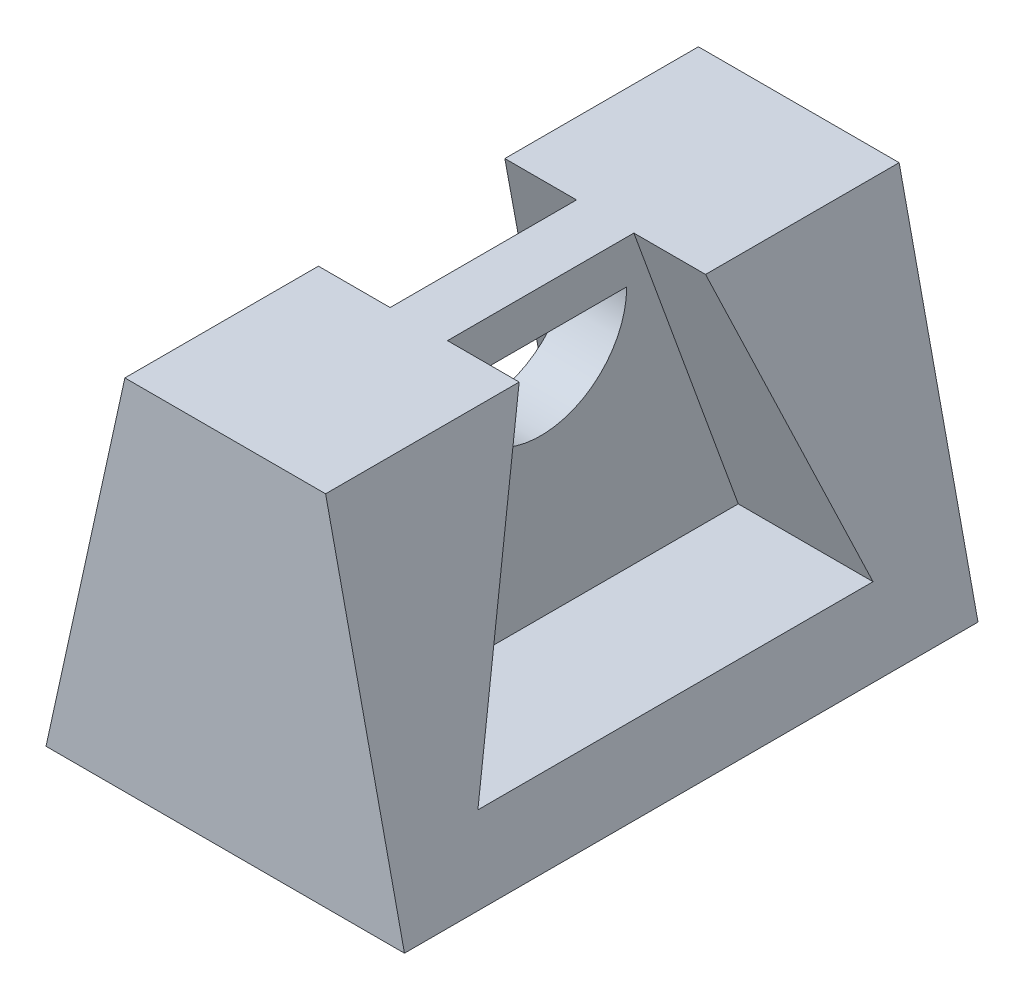
from build123d import *

# Parameters (mm, degrees)
EXTRUDE_1_DEPTH     = 40
CUT_EXTRUDE_START   = -4
CUT_EXTRUDE_2_DEPTH = 50
CUT_EXTRUDE_3_DEPTH = 8


with BuildPart() as part:
    # 草图3 → 凸台-拉伸1 (new, symmetric)
    with BuildSketch(Plane.XY):
        Polygon((14, 42.647058824), (-14, 42.647058824), (-25, -7.352941176), (25, -7.352941176), align=None)
    extrude(amount=EXTRUDE_1_DEPTH, both=True)

    # 草图4 → 切除-拉伸2 (cut)
    with BuildSketch(Plane(origin=(0, 0, 0), x_dir=(0, 0, -1), z_dir=(1, 0, 0)).offset(CUT_EXTRUDE_START)):
        Polygon((13, 42.647058824), (-13, 42.647058824), (-27.558809371, 2.647058824), (27.558809371, 2.647058824), align=None)
    cut_extrude_2 = extrude(amount=-CUT_EXTRUDE_2_DEPTH, mode=Mode.SUBTRACT)

    # 镜向1: 切除-拉伸2 across plane
    add(cut_extrude_2.mirror(Plane(origin=(0, 0, 0), x_dir=(0, 0, 1), z_dir=(1, 0, 0))), mode=Mode.SUBTRACT)

    # 草图6 → 切除-拉伸3 (cut)
    with BuildSketch(Plane.ZY.offset(4)):
        with BuildLine():
            Line((-12, 36.647058824), (12, 36.647058824))
            ThreePointArc((12, 36.647058824), (0, 24.647058824), (-12, 36.647058824))
        make_face()
    extrude(amount=-CUT_EXTRUDE_3_DEPTH, mode=Mode.SUBTRACT)


solid = part.part
